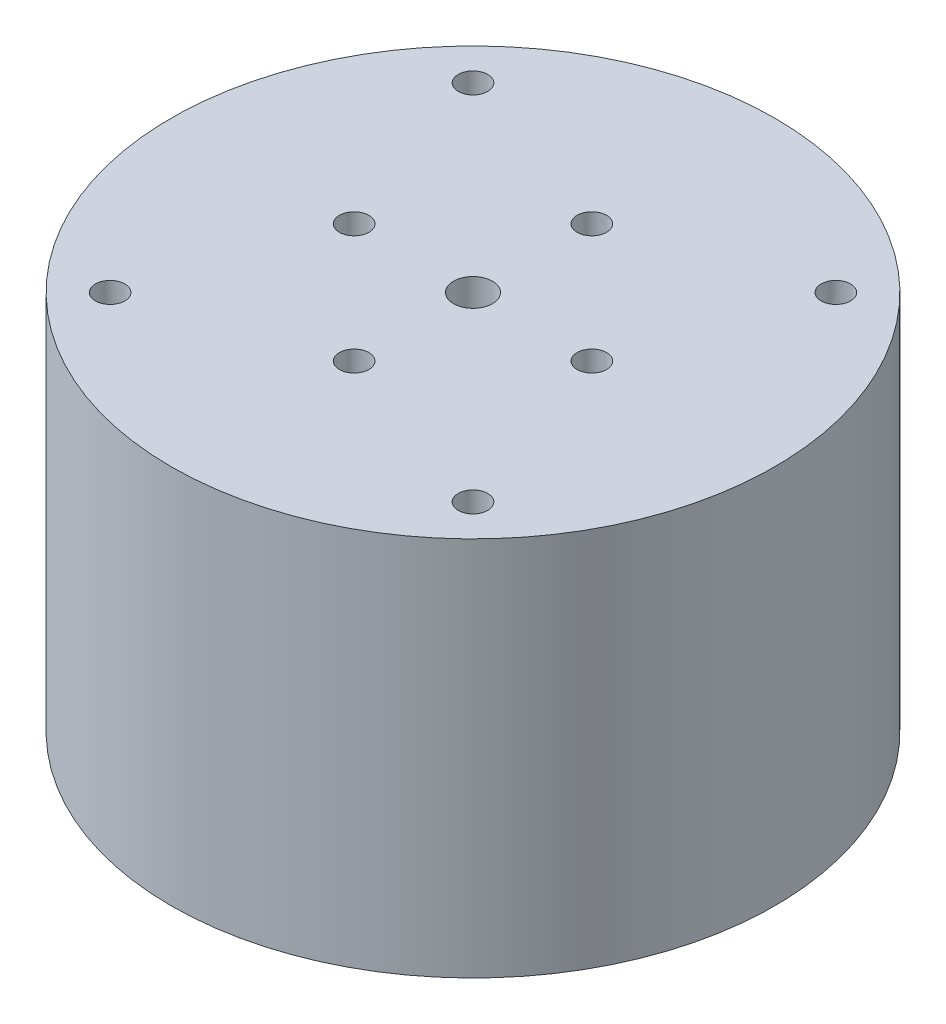
from build123d import *

# Parameters (mm, degrees)
SKETCH1_R           = 31.75
SKETCH1_R_2         = 2.05
SKETCH1_R_3         = 1.55
BOSS_EXTRUDE1_DEPTH = 40
SKETCH2_R           = 6.5
CUT_EXTRUDE1_DEPTH  = 30


with BuildPart() as part:
    # Sketch1 → Boss-Extrude1 (new body)
    with BuildSketch(Plane(origin=(0, 0, 0), x_dir=(1, 0, 0), z_dir=(0, 1, 0))):
        with Locations(Location((0, 0, 0), (0, 0, 270))):
            Circle(SKETCH1_R)
        with Locations(Location((0, 0, 0), (0, 0, 270))):
            Circle(SKETCH1_R_2, mode=Mode.SUBTRACT)
        with Locations(Location((0, 12.5, 0), (0, 0, 270))):
            Circle(SKETCH1_R_3, mode=Mode.SUBTRACT)
        with Locations(Location((12.5, 0, 0), (0, 0, 270))):
            Circle(SKETCH1_R_3, mode=Mode.SUBTRACT)
        with Locations(Location((0, -12.5, 0), (0, 0, 270))):
            Circle(SKETCH1_R_3, mode=Mode.SUBTRACT)
        with Locations(Location((-12.5, 0, 0), (0, 0, 270))):
            Circle(SKETCH1_R_3, mode=Mode.SUBTRACT)
        with Locations(Location((19.083044257, 19.083044257, 0), (0, 0, 270))):
            Circle(SKETCH1_R_3, mode=Mode.SUBTRACT)
        with Locations(Location((19.083044257, -19.083044257, 0), (0, 0, 270))):
            Circle(SKETCH1_R_3, mode=Mode.SUBTRACT)
        with Locations(Location((-19.083044257, -19.083044257, 0), (0, 0, 270))):
            Circle(SKETCH1_R_3, mode=Mode.SUBTRACT)
        with Locations(Location((-19.083044257, 19.083044257, 0), (0, 0, 270))):
            Circle(SKETCH1_R_3, mode=Mode.SUBTRACT)
    extrude(amount=BOSS_EXTRUDE1_DEPTH)

    # Sketch2 → Cut-Extrude1 (cut)
    with BuildSketch(Plane.XZ):
        with Locations(Location((0, 0, 0), (0, 0, 270))):
            Circle(SKETCH2_R)
    extrude(amount=-CUT_EXTRUDE1_DEPTH, mode=Mode.SUBTRACT)


solid = part.part
